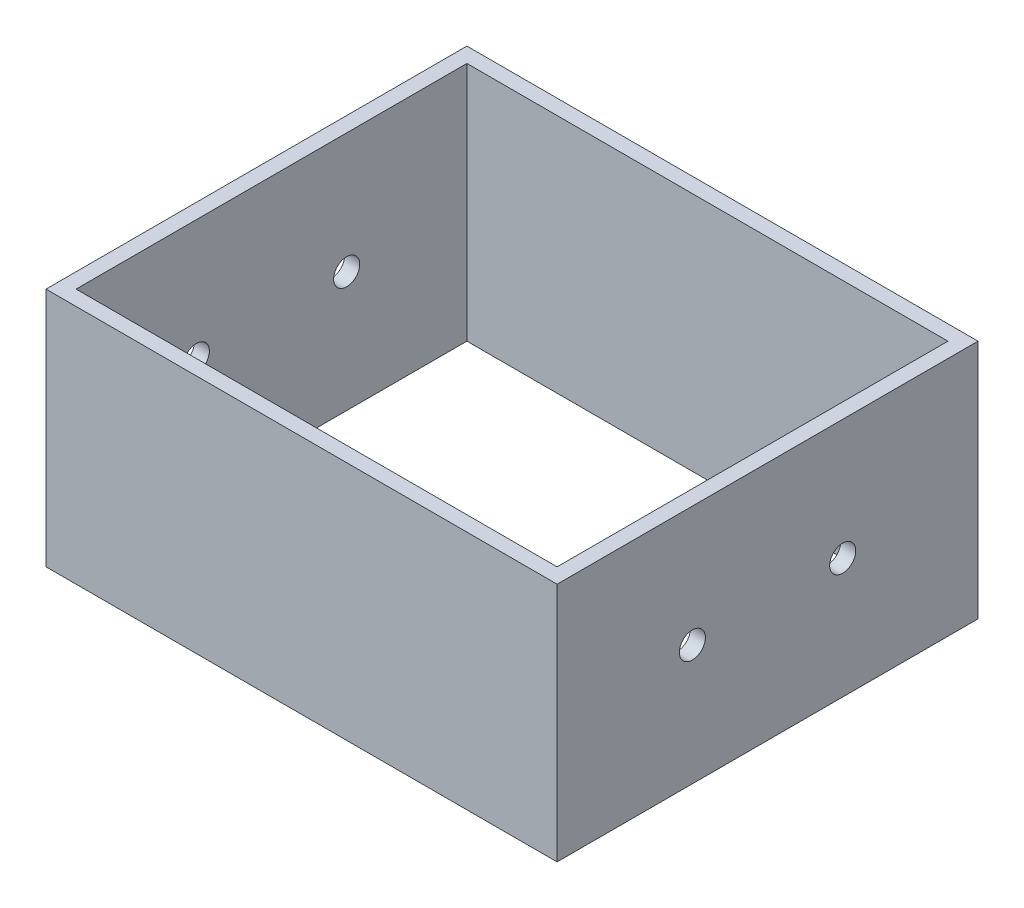
from build123d import *

# Parameters (mm, degrees)
SKETCH1_W           = 215.9
SKETCH1_H           = 177.8
SKETCH1_W_2         = 203.2
SKETCH1_H_2         = 165.1
BOSS_EXTRUDE1_DEPTH = 101.6
SKETCH2_R           = 5.499261314
CUT_EXTRUDE1_DEPTH  = 294.820476652


with BuildPart() as part:
    # Sketch1 → Boss-Extrude1 (new body)
    with BuildSketch(Plane(origin=(0, 0, 0), x_dir=(1, 0, 0), z_dir=(0, 1, 0))):
        with Locations((101.6, 82.55)):
            Rectangle(SKETCH1_W, SKETCH1_H)
        with Locations((101.6, 82.55)):
            Rectangle(SKETCH1_W_2, SKETCH1_H_2, mode=Mode.SUBTRACT)
    extrude(amount=BOSS_EXTRUDE1_DEPTH)

    # Sketch2 → Cut-Extrude1 (cut, through all)
    with BuildSketch(Plane(origin=(209.55, 0, 0), x_dir=(0, 0, -1), z_dir=(1, 0, 0))):
        with Locations((50.8, 50.8)):
            Circle(SKETCH2_R)
        with Locations((114.3, 50.8)):
            Circle(SKETCH2_R)
    extrude(amount=-CUT_EXTRUDE1_DEPTH, mode=Mode.SUBTRACT)


solid = part.part
